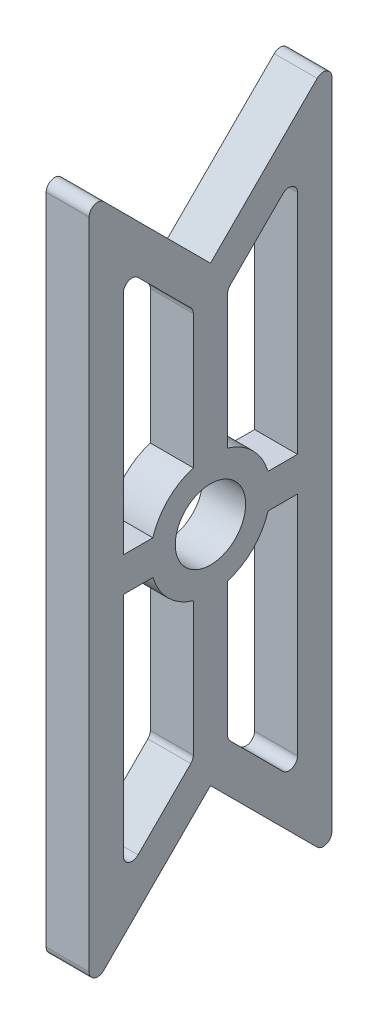
from build123d import *

# Parameters (mm, degrees)
BOSS_EXTRUDE1_DEPTH = 5
CUT_EXTRUDE1_DEPTH  = 86.941840799
BOSS_EXTRUDE2_DEPTH = 5
SKETCH7_R           = 4.1
CUT_EXTRUDE2_DEPTH  = 86.941840799
FILLET1_R           = 1


with BuildPart() as part:
    # Sketch1 → Boss-Extrude1 (new body)
    with BuildSketch(Plane(origin=(0, 0, 0), x_dir=(0, 0, -1), z_dir=(1, 0, 0))):
        Polygon((0, 0), (0, -81), (14.142135624, -66.857864376), (28.284271247, -81), (28.284271247, 0), (14.142135624, -14.142135624), align=None)
    extrude(amount=BOSS_EXTRUDE1_DEPTH)

    # Sketch2 → Cut-Extrude1 (cut, through all)
    with BuildSketch(Plane(origin=(5, 0, 0), x_dir=(0, 0, -1), z_dir=(1, 0, 0))):
        Polygon((4, -71.343145751), (12.142135624, -63.201010127), (12.142135624, -17.798989873), (4, -9.656854249), align=None)
        Polygon((16.142135624, -17.798989873), (16.142135624, -63.201010127), (24.284271247, -71.343145751), (24.284271247, -9.656854249), align=None)
    extrude(amount=-CUT_EXTRUDE1_DEPTH, mode=Mode.SUBTRACT)

    # Sketch6 → Boss-Extrude2 (add, through all)
    with BuildSketch(Plane(origin=(5, 0, 0), x_dir=(0, 0, -1), z_dir=(1, 0, 0))):
        with BuildLine():
            Line((20.850339556, -42.5), (16.142135624, -42.5))
            Line((16.142135624, -42.5), (16.142135624, -47.208203932))
            ThreePointArc((16.142135624, -47.208203932), (19.091883092, -45.449747468), (20.850339556, -42.5))
        make_face()
        with BuildLine():
            Line((20.850339556, -38.5), (16.142135624, -38.5))
            Line((16.142135624, -38.5), (16.142135624, -42.5))
            Line((16.142135624, -42.5), (20.850339556, -42.5))
            ThreePointArc((20.850339556, -42.5), (21.068802482, -41.510587075), (21.142135624, -40.5))
            ThreePointArc((21.142135624, -40.5), (21.068802482, -39.489412925), (20.850339556, -38.5))
        make_face()
        with BuildLine():
            Line((16.142135624, -33.791796068), (16.142135624, -38.5))
            Line((16.142135624, -38.5), (20.850339556, -38.5))
            ThreePointArc((20.850339556, -38.5), (19.091883092, -35.550252532), (16.142135624, -33.791796068))
        make_face()
        with BuildLine():
            ThreePointArc((12.142135624, -33.791796068), (9.192388155, -35.550252532), (7.433931691, -38.5))
            Line((7.433931691, -38.5), (12.142135624, -38.5))
            Line((12.142135624, -38.5), (12.142135624, -33.791796068))
        make_face()
        with BuildLine():
            Line((12.142135624, -42.5), (7.433931691, -42.5))
            ThreePointArc((7.433931691, -42.5), (9.192388155, -45.449747468), (12.142135624, -47.208203932))
            Line((12.142135624, -47.208203932), (12.142135624, -42.5))
        make_face()
        with BuildLine():
            Line((12.142135624, -38.5), (7.433931691, -38.5))
            ThreePointArc((7.433931691, -38.5), (7.142135624, -40.5), (7.433931691, -42.5))
            Line((7.433931691, -42.5), (12.142135624, -42.5))
            Line((12.142135624, -42.5), (12.142135624, -38.5))
        make_face()
        with BuildLine():
            Line((7.433931691, -38.5), (4, -38.5))
            Line((4, -38.5), (4, -42.5))
            Line((4, -42.5), (7.433931691, -42.5))
            ThreePointArc((7.433931691, -42.5), (7.142135624, -40.5), (7.433931691, -38.5))
        make_face()
        with BuildLine():
            Line((24.284271247, -38.5), (20.850339556, -38.5))
            ThreePointArc((20.850339556, -38.5), (21.068802482, -39.489412925), (21.142135624, -40.5))
            ThreePointArc((21.142135624, -40.5), (21.068802482, -41.510587075), (20.850339556, -42.5))
            Line((20.850339556, -42.5), (24.284271247, -42.5))
            Line((24.284271247, -42.5), (24.284271247, -38.5))
        make_face()
    extrude(amount=-BOSS_EXTRUDE2_DEPTH)

    # Sketch7 → Cut-Extrude2 (cut, through all)
    with BuildSketch(Plane(origin=(5, 0, 0), x_dir=(0, 0, -1), z_dir=(1, 0, 0))):
        with Locations((14.142135624, -40.5)):
            Circle(SKETCH7_R)
    extrude(amount=-CUT_EXTRUDE2_DEPTH, mode=Mode.SUBTRACT)

    # Fillet1
    fillet1_edges = [part.edges().sort_by_distance(p)[0] for p in [
        (2.5, 0, 0),
        (2.5, 0, -28.284271247),
        (2.5, -81, -28.284271247),
        (2.5, -81, 0),
        (2.5, -17.798989873, -12.142135624),
        (2.5, -63.201010127, -12.142135624),
        (2.5, -71.343145751, -4),
        (2.5, -9.656854249, -4),
        (2.5, -9.656854249, -24.284271247),
        (2.5, -71.343145751, -24.284271247),
        (2.5, -63.201010127, -16.142135624),
        (2.5, -17.798989873, -16.142135624),
    ]]
    fillet(fillet1_edges, radius=FILLET1_R)


solid = part.part
